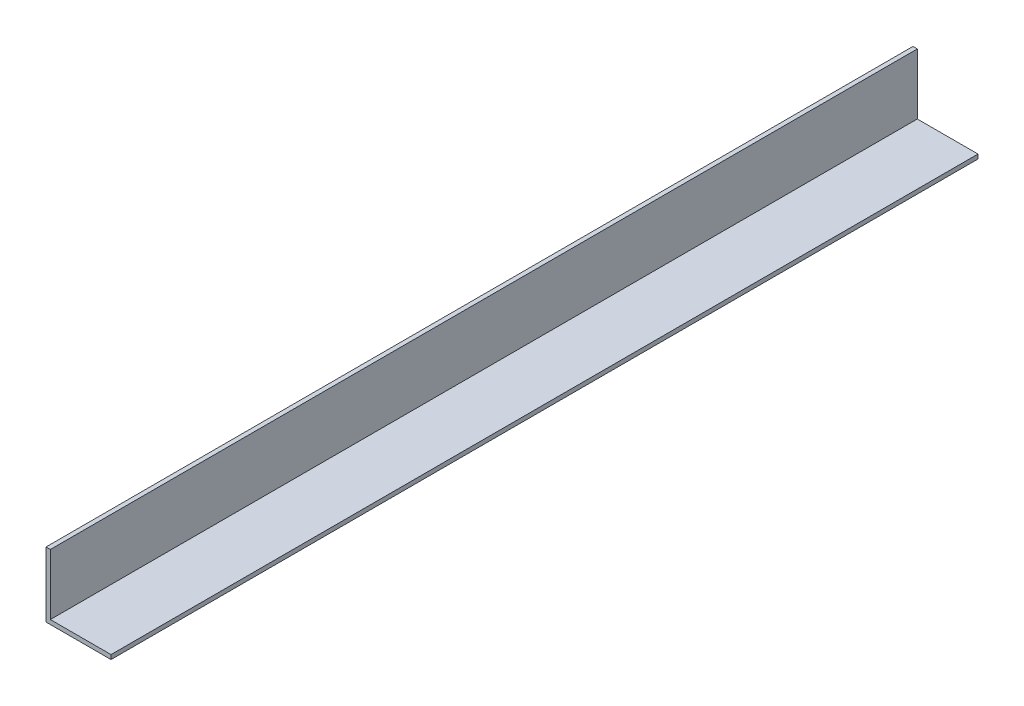
from build123d import *

# Parameters (mm, degrees)
BOSS_EXTRUDE1_DEPTH = 400


with BuildPart() as part:
    # Sketch1 → Boss-Extrude1 (new body)
    with BuildSketch(Plane.XY):
        Polygon((0, 5.602318429), (0, 35.602318429), (2, 35.602318429), (2, 7.602318429), (30, 7.602318429), (30, 5.602318429), align=None)
    extrude(amount=BOSS_EXTRUDE1_DEPTH)


solid = part.part
